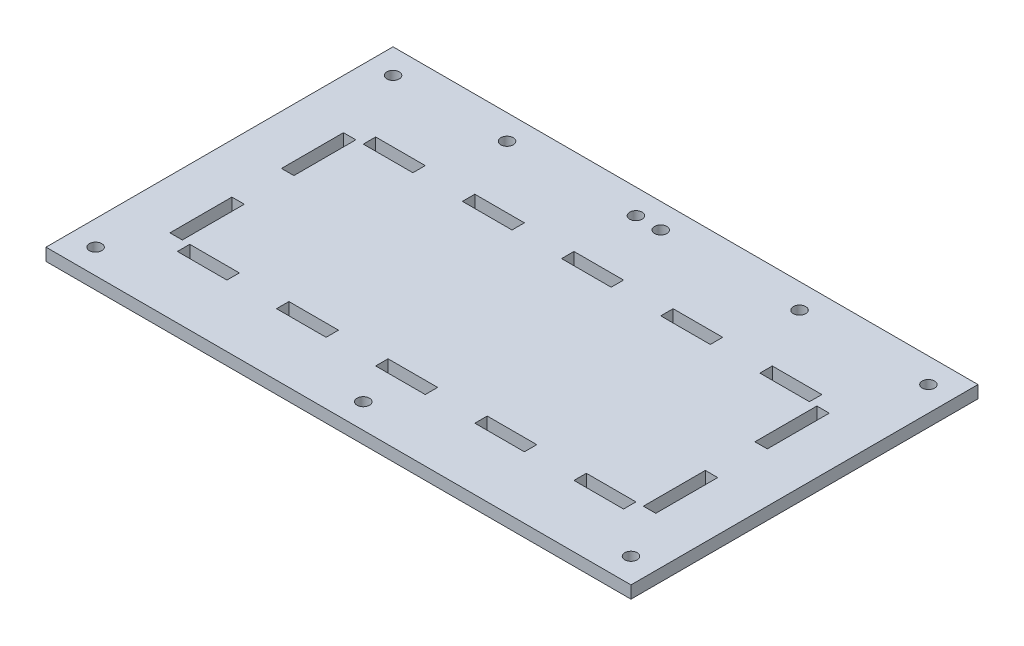
from build123d import *

# Parameters (mm, degrees)
SKETCH_1_W                       = 236
SKETCH_1_H                       = 140
EXTRUDE_1_DEPTH                  = 5
CUT_EXTRUDE_1_REACH              = 139.292
SKETCH_2_W                       = 20
SKETCH_2_H                       = 5
PATTERN_LINEAR_1_COUNT           = 3
PATTERN_LINEAR_1_PITCH           = 40
PATTERN_LINEAR_2_COUNT           = 3
PATTERN_LINEAR_2_PITCH           = 40
CUT_EXTRUDE_2_REACH              = 139.292
SKETCH_3_W                       = 5
SKETCH_3_H                       = 25
PATTERN_LINEAR_6_COUNT           = 2
PATTERN_LINEAR_6_PITCH           = 75
PATTERN_LINEAR_6_COPY_1_REACH    = 139.292
PATTERN_LINEAR_6_COPY_1_SKETCH_W = 20
PATTERN_LINEAR_6_COPY_1_SKETCH_H = 5
PATTERN_LINEAR_6_COPY_2_REACH    = 139.292
PATTERN_LINEAR_6_COPY_2_SKETCH_W = 20
PATTERN_LINEAR_6_COPY_2_SKETCH_H = 5
PATTERN_LINEAR_6_COPY_3_REACH    = 139.292
PATTERN_LINEAR_6_COPY_3_SKETCH_W = 20
PATTERN_LINEAR_6_COPY_3_SKETCH_H = 5
PATTERN_LINEAR_6_COPY_4_REACH    = 139.292
PATTERN_LINEAR_6_COPY_4_SKETCH_W = 20
PATTERN_LINEAR_6_COPY_4_SKETCH_H = 5
PATTERN_LINEAR_7_COUNT           = 2
PATTERN_LINEAR_7_PITCH           = 45
PATTERN_LINEAR_7_COPY_1_REACH    = 139.292
PATTERN_LINEAR_7_COPY_1_SKETCH_W = 5
PATTERN_LINEAR_7_COPY_1_SKETCH_H = 25
SKETCH_4_R                       = 2.5
CUT_EXTRUDE_3_DEPTH              = 10


with BuildPart() as part:
    # 스케치1 → 보스-돌출1 (new body)
    with BuildSketch(Plane(origin=(0, 0, 0), x_dir=(1, 0, 0), z_dir=(0, 1, 0))):
        Rectangle(SKETCH_1_W, SKETCH_1_H)
    extrude(amount=EXTRUDE_1_DEPTH)

    # 스케치2 → 컷-돌출1 (cut, up to next)
    with BuildSketch(Plane(origin=(0, 5, 0), x_dir=(1, 0, 0), z_dir=(0, 1, 0)), mode=Mode.PRIVATE) as cut_extrude_1_sk1:
        with Locations((0, -42.5)):
            Rectangle(SKETCH_2_W, SKETCH_2_H)
    cut_extrude_1_tool1 = extrude(cut_extrude_1_sk1.sketch, amount=-CUT_EXTRUDE_1_REACH, mode=Mode.PRIVATE) & part.part
    cut_extrude_1 = cut_extrude_1_tool1.solids().sort_by_distance((0, 5, 42.5))[0]
    add(cut_extrude_1, mode=Mode.SUBTRACT)

    # 선형 패턴1: 컷-돌출1 ×3
    with Locations(*[(i * PATTERN_LINEAR_1_PITCH, 0, 0) for i in range(1, PATTERN_LINEAR_1_COUNT)]):
        add(cut_extrude_1, mode=Mode.SUBTRACT)

    # 선형 패턴2: 컷-돌출1 ×3
    with Locations(*[(-i * PATTERN_LINEAR_2_PITCH, 0, 0) for i in range(1, PATTERN_LINEAR_2_COUNT)]):
        add(cut_extrude_1, mode=Mode.SUBTRACT)

    # 스케치3 → 컷-돌출2 (cut, up to next)
    with BuildSketch(Plane(origin=(0, 5, 0), x_dir=(1, 0, 0), z_dir=(0, 1, 0)), mode=Mode.PRIVATE) as cut_extrude_2_sk1:
        with Locations((95.5, -27.5)):
            Rectangle(SKETCH_3_W, SKETCH_3_H)
    cut_extrude_2_tool1 = extrude(cut_extrude_2_sk1.sketch, amount=-CUT_EXTRUDE_2_REACH, mode=Mode.PRIVATE) & part.part
    cut_extrude_2 = cut_extrude_2_tool1.solids().sort_by_distance((95.5, 5, 27.5))[0]
    add(cut_extrude_2, mode=Mode.SUBTRACT)

    # 대칭 복사3: 컷-돌출2 across plane
    add(cut_extrude_2.mirror(Plane(origin=(0, 0, 0), x_dir=(0, 0, 1), z_dir=(1, 0, 0))), mode=Mode.SUBTRACT)

    # 선형 패턴6: 컷-돌출1 ×2
    with Locations(*[(0, 0, -i * PATTERN_LINEAR_6_PITCH) for i in range(1, PATTERN_LINEAR_6_COUNT)]):
        add(cut_extrude_1, mode=Mode.SUBTRACT)

    # 선형 패턴6 copy 1 sketch → 선형 패턴6 copy 1 (cut, up to next)
    with BuildSketch(Plane(origin=(40, 5, -75), x_dir=(1, 0, 0), z_dir=(0, 1, 0)), mode=Mode.PRIVATE) as pattern_linear_6_copy_1_sk1:
        with Locations((0, -42.5)):
            Rectangle(PATTERN_LINEAR_6_COPY_1_SKETCH_W, PATTERN_LINEAR_6_COPY_1_SKETCH_H)
    pattern_linear_6_copy_1_tool1 = extrude(pattern_linear_6_copy_1_sk1.sketch, amount=-PATTERN_LINEAR_6_COPY_1_REACH, mode=Mode.PRIVATE) & part.part
    add(pattern_linear_6_copy_1_tool1.solids().sort_by_distance((40, 5, -32.5))[0], mode=Mode.SUBTRACT)

    # 선형 패턴6 copy 2 sketch → 선형 패턴6 copy 2 (cut, up to next)
    with BuildSketch(Plane(origin=(80, 5, -75), x_dir=(1, 0, 0), z_dir=(0, 1, 0)), mode=Mode.PRIVATE) as pattern_linear_6_copy_2_sk1:
        with Locations((0, -42.5)):
            Rectangle(PATTERN_LINEAR_6_COPY_2_SKETCH_W, PATTERN_LINEAR_6_COPY_2_SKETCH_H)
    pattern_linear_6_copy_2_tool1 = extrude(pattern_linear_6_copy_2_sk1.sketch, amount=-PATTERN_LINEAR_6_COPY_2_REACH, mode=Mode.PRIVATE) & part.part
    add(pattern_linear_6_copy_2_tool1.solids().sort_by_distance((80, 5, -32.5))[0], mode=Mode.SUBTRACT)

    # 선형 패턴6 copy 3 sketch → 선형 패턴6 copy 3 (cut, up to next)
    with BuildSketch(Plane(origin=(-40, 5, -75), x_dir=(1, 0, 0), z_dir=(0, 1, 0)), mode=Mode.PRIVATE) as pattern_linear_6_copy_3_sk1:
        with Locations((0, -42.5)):
            Rectangle(PATTERN_LINEAR_6_COPY_3_SKETCH_W, PATTERN_LINEAR_6_COPY_3_SKETCH_H)
    pattern_linear_6_copy_3_tool1 = extrude(pattern_linear_6_copy_3_sk1.sketch, amount=-PATTERN_LINEAR_6_COPY_3_REACH, mode=Mode.PRIVATE) & part.part
    add(pattern_linear_6_copy_3_tool1.solids().sort_by_distance((-40, 5, -32.5))[0], mode=Mode.SUBTRACT)

    # 선형 패턴6 copy 4 sketch → 선형 패턴6 copy 4 (cut, up to next)
    with BuildSketch(Plane(origin=(-80, 5, -75), x_dir=(1, 0, 0), z_dir=(0, 1, 0)), mode=Mode.PRIVATE) as pattern_linear_6_copy_4_sk1:
        with Locations((0, -42.5)):
            Rectangle(PATTERN_LINEAR_6_COPY_4_SKETCH_W, PATTERN_LINEAR_6_COPY_4_SKETCH_H)
    pattern_linear_6_copy_4_tool1 = extrude(pattern_linear_6_copy_4_sk1.sketch, amount=-PATTERN_LINEAR_6_COPY_4_REACH, mode=Mode.PRIVATE) & part.part
    add(pattern_linear_6_copy_4_tool1.solids().sort_by_distance((-80, 5, -32.5))[0], mode=Mode.SUBTRACT)

    # 선형 패턴7: 컷-돌출2 ×2
    with Locations(*[(0, 0, -i * PATTERN_LINEAR_7_PITCH) for i in range(1, PATTERN_LINEAR_7_COUNT)]):
        add(cut_extrude_2, mode=Mode.SUBTRACT)

    # 선형 패턴7 copy 1 sketch → 선형 패턴7 copy 1 (cut, up to next)
    with BuildSketch(Plane(origin=(0, 5, -45), x_dir=(-1, 0, 0), z_dir=(0, 1, 0)), mode=Mode.PRIVATE) as pattern_linear_7_copy_1_sk1:
        with Locations((95.5, 27.5)):
            Rectangle(PATTERN_LINEAR_7_COPY_1_SKETCH_W, PATTERN_LINEAR_7_COPY_1_SKETCH_H)
    pattern_linear_7_copy_1_tool1 = extrude(pattern_linear_7_copy_1_sk1.sketch, amount=-PATTERN_LINEAR_7_COPY_1_REACH, mode=Mode.PRIVATE) & part.part
    add(pattern_linear_7_copy_1_tool1.solids().sort_by_distance((-95.5, 5, -17.5))[0], mode=Mode.SUBTRACT)

    # 스케치4 → 컷-돌출3 (cut)
    with BuildSketch(Plane(origin=(0, 5, 0), x_dir=(1, 0, 0), z_dir=(0, 1, 0))):
        with Locations(Location((-108, 60, 0), (0, 0, 270))):
            Circle(SKETCH_4_R)
        with Locations(Location((108, -60, 0), (0, 0, 270))):
            Circle(SKETCH_4_R)
        with Locations(Location((-108, -60, 0), (0, 0, 270))):
            Circle(SKETCH_4_R)
        with Locations(Location((108, 60, 0), (0, 0, 270))):
            Circle(SKETCH_4_R)
        with Locations(Location((0, 60, 0), (0, 0, 270))):
            Circle(SKETCH_4_R)
        with Locations(Location((0, -60, 0), (0, 0, 270))):
            Circle(SKETCH_4_R)
        with Locations(Location((-62, 60, 0), (0, 0, 270))):
            Circle(SKETCH_4_R)
        with Locations(Location((56, 60, 0), (0, 0, 270))):
            Circle(SKETCH_4_R)
        with Locations(Location((-10, 60, 0), (0, 0, 270))):
            Circle(SKETCH_4_R)
    extrude(amount=-CUT_EXTRUDE_3_DEPTH, mode=Mode.SUBTRACT)


solid = part.part
